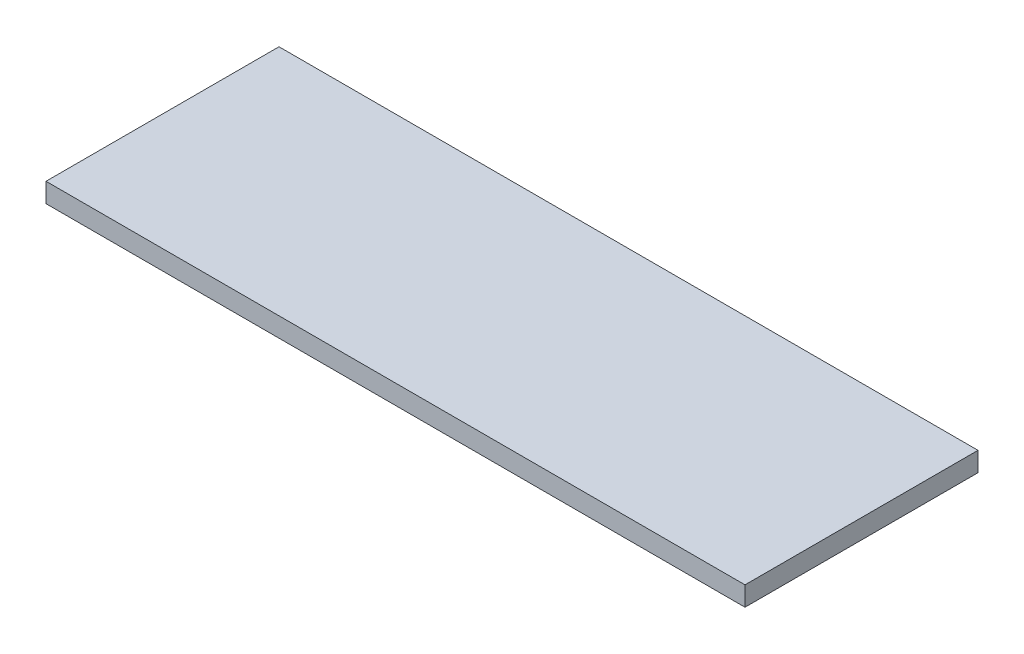
from build123d import *

# Parameters (mm, degrees)
SKETCH1_W           = 914.4
SKETCH1_H           = 304.8
BOSS_EXTRUDE1_DEPTH = 25.4


with BuildPart() as part:
    # Sketch1 → Boss-Extrude1 (new body)
    with BuildSketch(Plane(origin=(0, 0, 0), x_dir=(1, 0, 0), z_dir=(0, 1, 0))):
        Rectangle(SKETCH1_W, SKETCH1_H)
    extrude(amount=BOSS_EXTRUDE1_DEPTH)


solid = part.part
